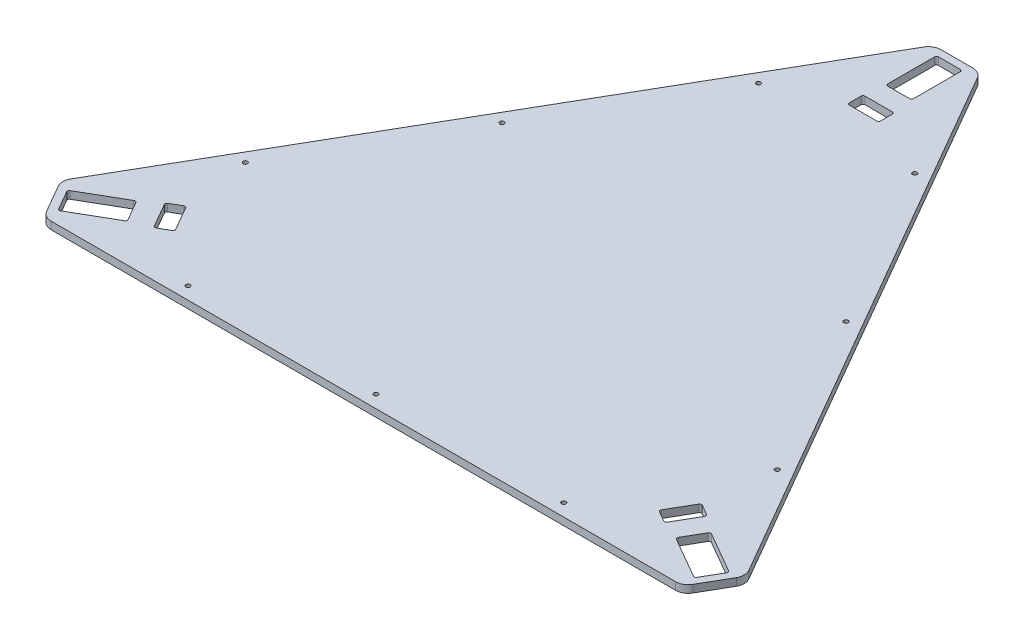
from build123d import *

# Parameters (mm, degrees)
SKETCH_1_W         = 20.5
SKETCH_1_H         = 40.5
SKETCH_1_W_2       = 25
SKETCH_1_H_2       = 12.5
EXTRUDE_1388_DEPTH = 3
FILLET_1_R         = 10
FILLET_2_R         = 1.5
HOLE_WIZARD_3_5_D  = 3.5


with BuildPart() as part:
    # Эскиз1 → Extrude 1388 (new, symmetric)
    with BuildSketch(Plane(origin=(0, 0, 0), x_dir=(1, 0, 0), z_dir=(0, 1, 0))):
        Polygon((273.664027596, -136.63804004), (18.5, 305.31902002), (-18.5, 305.31902002), (-273.664027596, -136.63804004), (-255.164027596, -168.68097998), (255.164027596, -168.68097998), align=None)
        Polygon((219.01884632, -138.286270399), (254.092875173, -158.536270399), (264.342875173, -140.782749621), (229.26884632, -120.532749621), align=None, mode=Mode.SUBTRACT)
        with Locations((0, 279.06902002)):
            Rectangle(SKETCH_1_W, SKETCH_1_H, mode=Mode.SUBTRACT)
        Polygon((-229.26884632, -120.532749621), (-264.342875173, -140.782749621), (-254.092875173, -158.536270399), (-219.01884632, -138.286270399), align=None, mode=Mode.SUBTRACT)
        Polygon((216.537439859, -110.584192463), (204.037439859, -132.234827557), (193.212122312, -125.984827557), (205.712122312, -104.334192463), align=None, mode=Mode.SUBTRACT)
        with Locations((0, 236.56902002)):
            Rectangle(SKETCH_1_W_2, SKETCH_1_H_2, mode=Mode.SUBTRACT)
        Polygon((-204.037439859, -132.234827557), (-216.537439859, -110.584192463), (-205.712122312, -104.334192463), (-193.212122312, -125.984827557), align=None, mode=Mode.SUBTRACT)
    extrude(amount=EXTRUDE_1388_DEPTH, both=True)

    # Скругление1
    fillet_1_edges = [part.edges().sort_by_distance(p)[0] for p in [
        (255.164027596, 0, 168.68097998),
        (-255.164027596, 0, 168.68097998),
        (-273.664027596, 0, 136.63804004),
        (-18.5, 0, -305.31902002),
        (18.5, 0, -305.31902002),
        (273.664027596, 0, 136.63804004),
    ]]
    fillet(fillet_1_edges, radius=FILLET_1_R)

    # Скругление2
    fillet_2_edges = [part.edges().sort_by_distance(p)[0] for p in [
        (10.25, 0, -258.81902002),
        (10.25, 0, -299.31902002),
        (-10.25, 0, -299.31902002),
        (-10.25, 0, -258.81902002),
        (12.5, 0, -230.31902002),
        (12.5, 0, -242.81902002),
        (-12.5, 0, -242.81902002),
        (-12.5, 0, -230.31902002),
        (229.26884632, 0, 120.532749621),
        (219.01884632, 0, 138.286270399),
        (254.092875173, 0, 158.536270399),
        (264.342875173, 0, 140.782749621),
        (-219.01884632, 0, 138.286270399),
        (-229.26884632, 0, 120.532749621),
        (-264.342875173, 0, 140.782749621),
        (-254.092875173, 0, 158.536270399),
        (193.212122312, 0, 125.984827557),
        (204.037439859, 0, 132.234827557),
        (216.537439859, 0, 110.584192463),
        (205.712122312, 0, 104.334192463),
        (-205.712122312, 0, 104.334192463),
        (-216.537439859, 0, 110.584192463),
        (-204.037439859, 0, 132.234827557),
        (-193.212122312, 0, 125.984827557),
    ]]
    fillet(fillet_2_edges, radius=FILLET_2_R)

    # Отверстия 3,5мм (through all)
    with Locations(Plane(origin=(0, 3, 0), x_dir=(1, 0, 0), z_dir=(0, 1, 0))):
        with Locations((-137.42175976, 79.34048999), (-62.42175976, 209.244300558), (62.42175976, 209.244300558), (137.42175976, 79.34048999), (212.42175976, -50.563320578), (150, -158.68097998), (0, -158.68097998), (-150, -158.68097998), (-212.42175976, -50.563320578)):
            Hole(HOLE_WIZARD_3_5_D / 2)


solid = part.part
